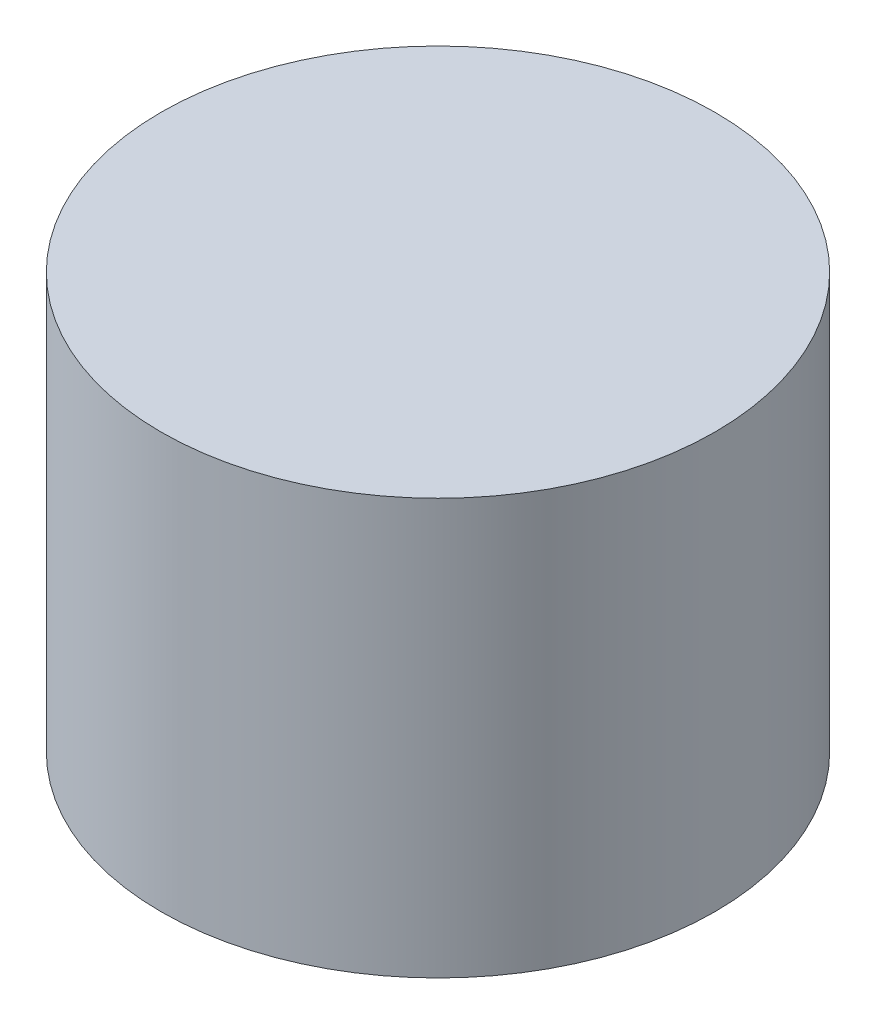
from build123d import *

# Parameters (mm, degrees)
SKETCH1_R           = 2
BOSS_EXTRUDE1_DEPTH = 3


with BuildPart() as part:
    # Sketch1 → Boss-Extrude1 (new body)
    with BuildSketch(Plane(origin=(0, 0, 0), x_dir=(1, 0, 0), z_dir=(0, 1, 0))):
        with Locations(Location((0, 0, 0), (0, 0, 270))):
            Circle(SKETCH1_R)
    extrude(amount=BOSS_EXTRUDE1_DEPTH)


solid = part.part
